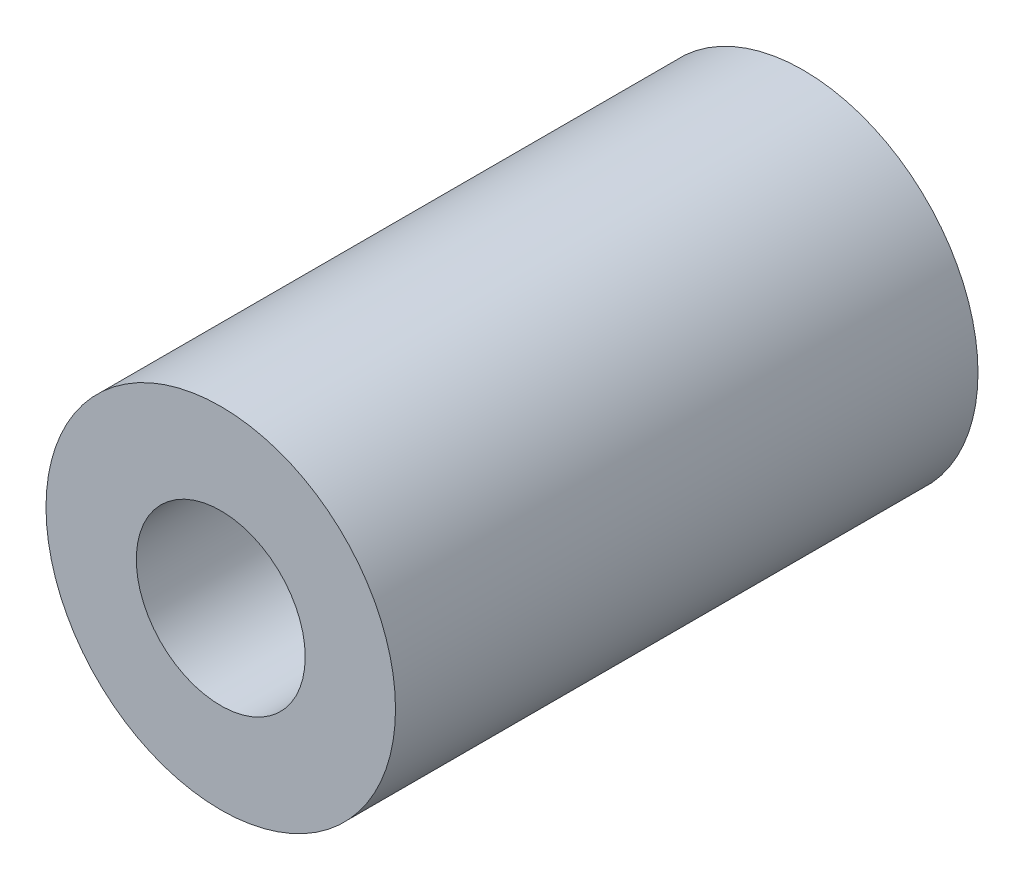
from build123d import *

# Parameters (mm, degrees)
IZIM1_R                     = 15
IZIM1_R_2                   = 7.25
Y_KSEKLIK_EKSTR_ZYON1_DEPTH = 50


with BuildPart() as part:
    # Çizim1 → Yükseklik-Ekstrüzyon1 (new body)
    with BuildSketch(Plane.XY):
        Circle(IZIM1_R)
        Circle(IZIM1_R_2, mode=Mode.SUBTRACT)
    extrude(amount=Y_KSEKLIK_EKSTR_ZYON1_DEPTH)


solid = part.part
